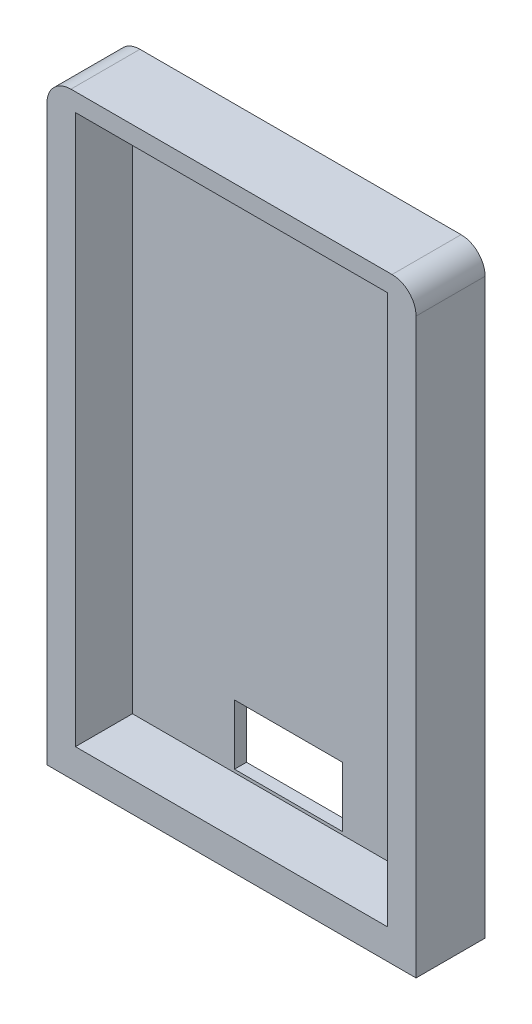
from build123d import *

# Parameters (mm, degrees)
ESQUISSE1_W        = 12.3
ESQUISSE1_H        = 19.9
ESQUISSE1_W_2      = 10.4
ESQUISSE1_H_2      = 18.3
BOSS_EXTRU_1_DEPTH = 2.3
ESQUISSE2_W        = 10.4
ESQUISSE2_H        = 18.3
ESQUISSE2_W_2      = 3.6
ESQUISSE2_H_2      = 2
BOSS_EXTRU_2_DEPTH = 0.4
CONG_1_R           = 0.8


with BuildPart() as part:
    # Esquisse1 → Boss.-Extru.1 (new body)
    with BuildSketch(Plane.XY.offset(18.1106)):
        with Locations((-3.99919357, -0.046839395)):
            Rectangle(ESQUISSE1_W, ESQUISSE1_H)
        with Locations((-3.99919357, 0.153160605)):
            Rectangle(ESQUISSE1_W_2, ESQUISSE1_H_2, mode=Mode.SUBTRACT)
    extrude(amount=-BOSS_EXTRU_1_DEPTH)

    # Esquisse2 → Boss.-Extru.2 (add)
    with BuildSketch(Plane(origin=(0, 0, 15.8106), x_dir=(-1, 0, 0), z_dir=(0, 0, -1))):
        with Locations((3.99919357, 0.153160605)):
            Rectangle(ESQUISSE2_W, ESQUISSE2_H)
        with Locations((3.99919357, -7.896839395)):
            Rectangle(ESQUISSE2_W_2, ESQUISSE2_H_2, mode=Mode.SUBTRACT)
    extrude(amount=-BOSS_EXTRU_2_DEPTH)

    # Congé1
    cong_1_edges = [part.edges().sort_by_distance(p)[0] for p in [
        (-10.14919357, 9.903160605, 16.9606),
        (2.15080643, 9.903160605, 16.9606),
    ]]
    fillet(cong_1_edges, radius=CONG_1_R)


solid = part.part
